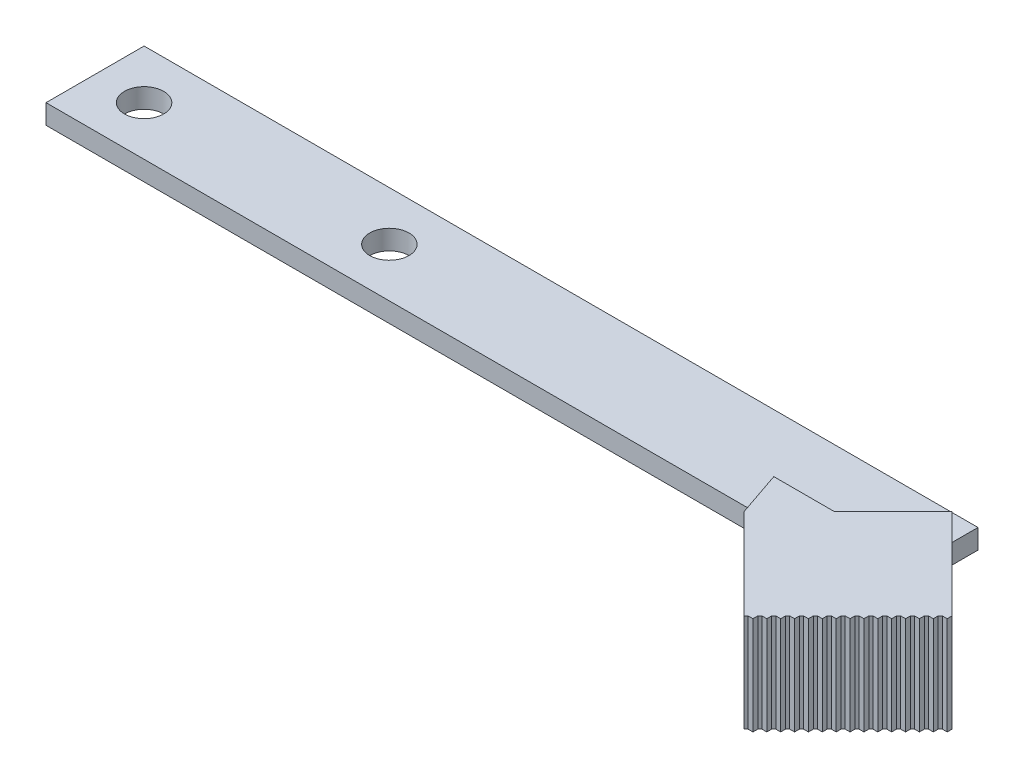
from build123d import *

# Parameters (mm, degrees)
SKETCH1_W           = 85
SKETCH1_H           = 10
SKETCH1_R           = 2
BOSS_EXTRUDE1_DEPTH = 2
CUT_EXTRUDE1_DEPTH  = 10
SKETCH3_W           = 15
SKETCH3_H           = 10
BOSS_EXTRUDE2_DEPTH = 13
BOSS_EXTRUDE3_DEPTH = 10
BOSS_EXTRUDE4_DEPTH = 10


with BuildPart() as part:
    # Sketch1 → Boss-Extrude1 (new body)
    with BuildSketch(Plane(origin=(0, 0, 0), x_dir=(1, 0, 0), z_dir=(0, 1, 0))):
        with Locations((18.270818553, 2.053936679)):
            Rectangle(SKETCH1_W, SKETCH1_H)
        with Locations(Location((-19.229181447, 2.053936679, 0), (0, 0, 270))):
            Circle(SKETCH1_R, mode=Mode.SUBTRACT)
        with Locations(Location((5.770818553, 2.053936679, 0), (0, 0, 270))):
            Circle(SKETCH1_R, mode=Mode.SUBTRACT)
    extrude(amount=BOSS_EXTRUDE1_DEPTH)

    # Sketch2 → Cut-Extrude1 (cut)
    with BuildSketch(Plane(origin=(0, 2, 0), x_dir=(1, 0, 0), z_dir=(0, 1, 0))):
        Polygon((60.770818553, 2.053936679), (55.770818553, -2.946063321), (60.770818553, -2.946063321), align=None)
    extrude(amount=-CUT_EXTRUDE1_DEPTH, mode=Mode.SUBTRACT)

    # Sketch3 → Boss-Extrude2 (add)
    with BuildSketch(Plane(origin=(29.358440937, 0, 29.358440937), x_dir=(0.7071067811865439, 0, -0.7071067811865511), z_dir=(0.7071067811865511, 0, 0.7071067811865439))):
        with Locations((38.590339713, 0.888307249)):
            Rectangle(SKETCH3_W, SKETCH3_H)
    extrude(amount=BOSS_EXTRUDE2_DEPTH)

    # Sketch4 → Boss-Extrude3 (add)
    with BuildSketch(Plane(origin=(0, 5.888307249, 0), x_dir=(1, 0, 0), z_dir=(0, 1, 0))):
        Polygon((51.342630977, -7.374250897), (49.762527896, -2.752596668), (55.964285206, -2.752596668), align=None)
    extrude(amount=-BOSS_EXTRUDE3_DEPTH)

    # Sketch5 → Boss-Extrude4 (add)
    with BuildSketch(Plane(origin=(0, 5.888307249, 0), x_dir=(1, 0, 0), z_dir=(0, 1, 0))):
        Polygon((71.141620851, -5.960037335), (71.141620851, -6.460037335), (70.641620851, -6.460037335), align=None)
        Polygon((70.434514069, -6.667144116), (70.434514069, -7.167144116), (69.934514069, -7.167144116), align=None)
        Polygon((69.727407288, -7.374250897), (69.727407288, -7.874250897), (69.227407288, -7.874250897), align=None)
        Polygon((69.020300507, -8.081357678), (69.020300507, -8.581357678), (68.520300507, -8.581357678), align=None)
        Polygon((68.313193726, -8.788464459), (68.313193726, -9.288464459), (67.813193726, -9.288464459), align=None)
        Polygon((67.606086945, -9.495571241), (67.606086945, -9.995571241), (67.106086945, -9.995571241), align=None)
        Polygon((66.898980164, -10.202678022), (66.898980164, -10.702678022), (66.398980164, -10.702678022), align=None)
        Polygon((66.191873382, -10.909784803), (66.191873382, -11.409784803), (65.691873382, -11.409784803), align=None)
        Polygon((65.484766601, -11.616891584), (65.484766601, -12.116891584), (64.984766601, -12.116891584), align=None)
        Polygon((64.77765982, -12.323998365), (64.77765982, -12.823998365), (64.27765982, -12.823998365), align=None)
        Polygon((64.070553039, -13.031105147), (64.070553039, -13.531105147), (63.570553039, -13.531105147), align=None)
        Polygon((63.363446258, -13.738211928), (63.363446258, -14.238211928), (62.863446258, -14.238211928), align=None)
        Polygon((62.656339476, -14.445318709), (62.656339476, -14.945318709), (62.156339476, -14.945318709), align=None)
        Polygon((61.949232695, -15.15242549), (61.949232695, -15.65242549), (61.449232695, -15.65242549), align=None)
        Polygon((61.242125914, -15.859532271), (61.242125914, -16.359532271), (60.742125914, -16.359532271), align=None)
    extrude(amount=-BOSS_EXTRUDE4_DEPTH)


solid = part.part
